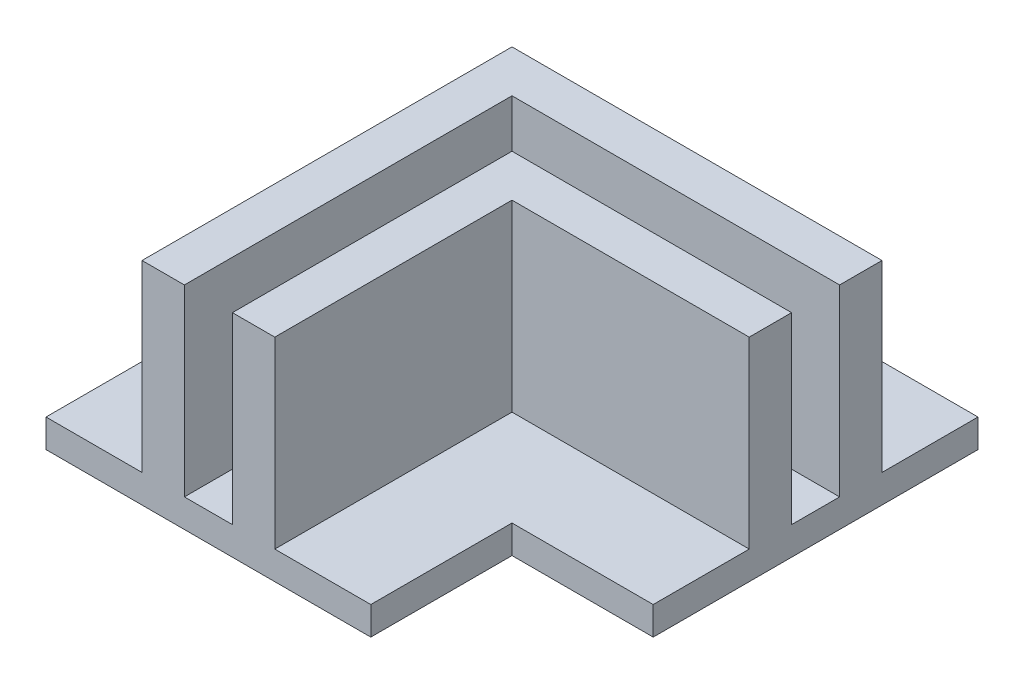
from build123d import *

# Parameters (mm, degrees)
ESQUISSE1_W              = 13
ESQUISSE1_H              = 20
BOSS_EXTRU_1_DEPTH       = 15
ESQUISSE2_W              = 2
ESQUISSE2_H              = 20
ESQUISSE2_W_2            = 3
ENL_V_MAT_EXTRU_2_DEPTH  = 13
ESQUISSE4_W              = 20
ESQUISSE4_H              = 2
BOSS_EXTRU_2_DEPTH       = 5
ESQUISSE5_W              = 20
ESQUISSE5_H              = 2
BOSS_EXTRU_3_DEPTH       = 5
ESQUISSE6_W              = 20
ESQUISSE6_H              = 13
ENL_V_MAT_EXTRU_3_DEPTH  = 0.2
ESQUISSE7_W              = 20
ESQUISSE7_H              = 13
ENL_V_MAT_EXTRU_4_DEPTH  = 0.2
ESQUISSE8_W              = 20
ESQUISSE8_H              = 13
BOSS_EXTRU_4_DEPTH       = 0.2
ESQUISSE9_W              = 20
ESQUISSE9_H              = 13
BOSS_EXTRU_5_DEPTH       = 0.2
ENL_V_MAT_EXTRU_5_DEPTH  = 10
BOSS_EXTRU_6_DEPTH       = 2
ESQUISSE13_W             = 3
ESQUISSE13_H             = 23
BOSS_EXTRU_7_DEPTH       = 13
ESQUISSE14_W             = 16.8
ESQUISSE14_H             = 3
ESQUISSE14_W_2           = 16.2
BOSS_EXTRU_8_DEPTH       = 13
ESQUISSE18_W             = 3.4
ESQUISSE18_H             = 13
ENL_V_MAT_EXTRU_8_DEPTH  = 10
ESQUISSE19_W             = 6.8
ESQUISSE19_H             = 13
ENL_V_MAT_EXTRU_9_DEPTH  = 10
ESQUISSE20_W             = 6.8
ESQUISSE20_H             = 13
ENL_V_MAT_EXTRU_10_DEPTH = 10
ESQUISSE21_W             = 3.4
ESQUISSE21_H             = 13
ENL_V_MAT_EXTRU_11_DEPTH = 5


with BuildPart() as part:
    # Esquisse1 → Boss.-Extru.1 (new body)
    with BuildSketch(Plane(origin=(0, 0, 0), x_dir=(1, 0, 0), z_dir=(0, 1, 0))):
        with Locations((-1.892857143, 1.160714286)):
            Rectangle(ESQUISSE1_W, ESQUISSE1_H)
    extrude(amount=BOSS_EXTRU_1_DEPTH)

    # Esquisse2 → Enlèv. mat.-Extru.2 (cut)
    with BuildSketch(Plane(origin=(0, 15, 0), x_dir=(1, 0, 0), z_dir=(0, 1, 0))):
        with Locations((-7.392857143, 1.160714286)):
            Rectangle(ESQUISSE2_W, ESQUISSE2_H)
        with Locations((-1.892857143, 1.160714286)):
            Rectangle(ESQUISSE2_W_2, ESQUISSE2_H)
        with Locations((3.607142857, 1.160714286)):
            Rectangle(ESQUISSE2_W, ESQUISSE2_H)
    extrude(amount=-ENL_V_MAT_EXTRU_2_DEPTH, mode=Mode.SUBTRACT)

    # Esquisse4 → Boss.-Extru.2 (add)
    with BuildSketch(Plane.ZY.offset(8.392857143)):
        with Locations((-1.160714286, 1)):
            Rectangle(ESQUISSE4_W, ESQUISSE4_H)
    extrude(amount=BOSS_EXTRU_2_DEPTH)

    # Esquisse5 → Boss.-Extru.3 (add)
    with BuildSketch(Plane(origin=(4.607142857, 0, 0), x_dir=(0, 0, -1), z_dir=(1, 0, 0))):
        with Locations((1.160714286, 1)):
            Rectangle(ESQUISSE5_W, ESQUISSE5_H)
    extrude(amount=BOSS_EXTRU_3_DEPTH)

    # Esquisse6 → Enlèv. mat.-Extru.3 (cut)
    with BuildSketch(Plane.ZY.offset(0.392857143)):
        with Locations((-1.160714286, 8.5)):
            Rectangle(ESQUISSE6_W, ESQUISSE6_H)
    extrude(amount=-ENL_V_MAT_EXTRU_3_DEPTH, mode=Mode.SUBTRACT)

    # Esquisse7 → Enlèv. mat.-Extru.4 (cut)
    with BuildSketch(Plane(origin=(-3.392857143, 0, 0), x_dir=(0, 0, -1), z_dir=(1, 0, 0))):
        with Locations((1.160714286, 8.5)):
            Rectangle(ESQUISSE7_W, ESQUISSE7_H)
    extrude(amount=-ENL_V_MAT_EXTRU_4_DEPTH, mode=Mode.SUBTRACT)

    # Esquisse8 → Boss.-Extru.4 (add)
    with BuildSketch(Plane(origin=(2.607142857, 0, 0), x_dir=(0, 0, -1), z_dir=(1, 0, 0))):
        with Locations((1.160714286, 8.5)):
            Rectangle(ESQUISSE8_W, ESQUISSE8_H)
    extrude(amount=BOSS_EXTRU_4_DEPTH)

    # Esquisse9 → Boss.-Extru.5 (add)
    with BuildSketch(Plane.ZY.offset(6.392857143)):
        with Locations((-1.160714286, 8.5)):
            Rectangle(ESQUISSE9_W, ESQUISSE9_H)
    extrude(amount=BOSS_EXTRU_5_DEPTH)

    # Esquisse11 → Enlèv. mat.-Extru.5 (cut)
    with BuildSketch(Plane(origin=(0, 0, -11.160714286), x_dir=(-1, 0, 0), z_dir=(0, 0, -1))):
        Polygon((6.592857143, 2), (6.592857143, 15), (3.592857143, 15), (3.592857143, 2), (0.192857143, 2), (0.192857143, 15), (-2.807142857, 15), (-2.807142857, 2), (-9.607142857, 2), (-9.607142857, 0), (13.392857143, 0), (13.392857143, 2), align=None)
    extrude(amount=-ENL_V_MAT_EXTRU_5_DEPTH, mode=Mode.SUBTRACT)

    # Esquisse12 → Boss.-Extru.6 (add)
    with BuildSketch(Plane(origin=(0, 0, 0), x_dir=(1, 0, 0), z_dir=(0, 1, 0))):
        Polygon((9.607142857, 1.160714286), (19.607142857, 1.160714286), (19.607142857, 24.160714286), (-13.392857143, 24.160714286), (-13.392857143, 1.160714286), align=None)
    extrude(amount=BOSS_EXTRU_6_DEPTH)

    # Esquisse13 → Boss.-Extru.7 (add)
    with BuildSketch(Plane(origin=(0, 2, 0), x_dir=(1, 0, 0), z_dir=(0, 1, 0))):
        Polygon((2.807142857, 1.160714286), (-0.192857143, 1.160714286), (-0.192857143, 24.160714286), (2.807142857, 24.160714286), (2.807142857, 1.789853377), align=None)
        with Locations((-5.092857143, 12.660714286)):
            Rectangle(ESQUISSE13_W, ESQUISSE13_H)
    extrude(amount=BOSS_EXTRU_7_DEPTH)

    # Esquisse14 → Boss.-Extru.8 (add)
    with BuildSketch(Plane(origin=(0, 2, 0), x_dir=(1, 0, 0), z_dir=(0, 1, 0))):
        with Locations((11.207142857, 9.460714286)):
            Rectangle(ESQUISSE14_W, ESQUISSE14_H)
        with Locations((11.207142857, 15.860714286)):
            Rectangle(ESQUISSE14_W, ESQUISSE14_H)
        with Locations((-5.292857143, 9.460714286)):
            Rectangle(ESQUISSE14_W_2, ESQUISSE14_H)
        with Locations((-5.292857143, 15.860714286)):
            Rectangle(ESQUISSE14_W_2, ESQUISSE14_H)
    extrude(amount=BOSS_EXTRU_8_DEPTH)

    # Esquisse18 → Enlèv. mat.-Extru.8 (cut)
    with BuildSketch(Plane(origin=(0, 0, -10.960714286), x_dir=(-1, 0, 0), z_dir=(0, 0, -1))):
        with Locations((1.892857143, 8.5)):
            Rectangle(ESQUISSE18_W, ESQUISSE18_H)
    extrude(amount=-ENL_V_MAT_EXTRU_8_DEPTH, mode=Mode.SUBTRACT)

    # Esquisse19 → Enlèv. mat.-Extru.9 (cut)
    with BuildSketch(Plane(origin=(0, 0, -17.360714286), x_dir=(-1, 0, 0), z_dir=(0, 0, -1))):
        with Locations((9.992857143, 8.5)):
            Rectangle(ESQUISSE19_W, ESQUISSE19_H)
    extrude(amount=-ENL_V_MAT_EXTRU_9_DEPTH, mode=Mode.SUBTRACT)

    # Esquisse20 → Enlèv. mat.-Extru.10 (cut)
    with BuildSketch(Plane(origin=(2.807142857, 0, 0), x_dir=(0, 0, -1), z_dir=(1, 0, 0))):
        with Locations((20.760714286, 8.5)):
            Rectangle(ESQUISSE20_W, ESQUISSE20_H)
    extrude(amount=-ENL_V_MAT_EXTRU_10_DEPTH, mode=Mode.SUBTRACT)

    # Esquisse21 → Enlèv. mat.-Extru.11 (cut)
    with BuildSketch(Plane(origin=(2.807142857, 0, 0), x_dir=(0, 0, -1), z_dir=(1, 0, 0))):
        with Locations((12.660714286, 8.5)):
            Rectangle(ESQUISSE21_W, ESQUISSE21_H)
    extrude(amount=-ENL_V_MAT_EXTRU_11_DEPTH, mode=Mode.SUBTRACT)


solid = part.part
